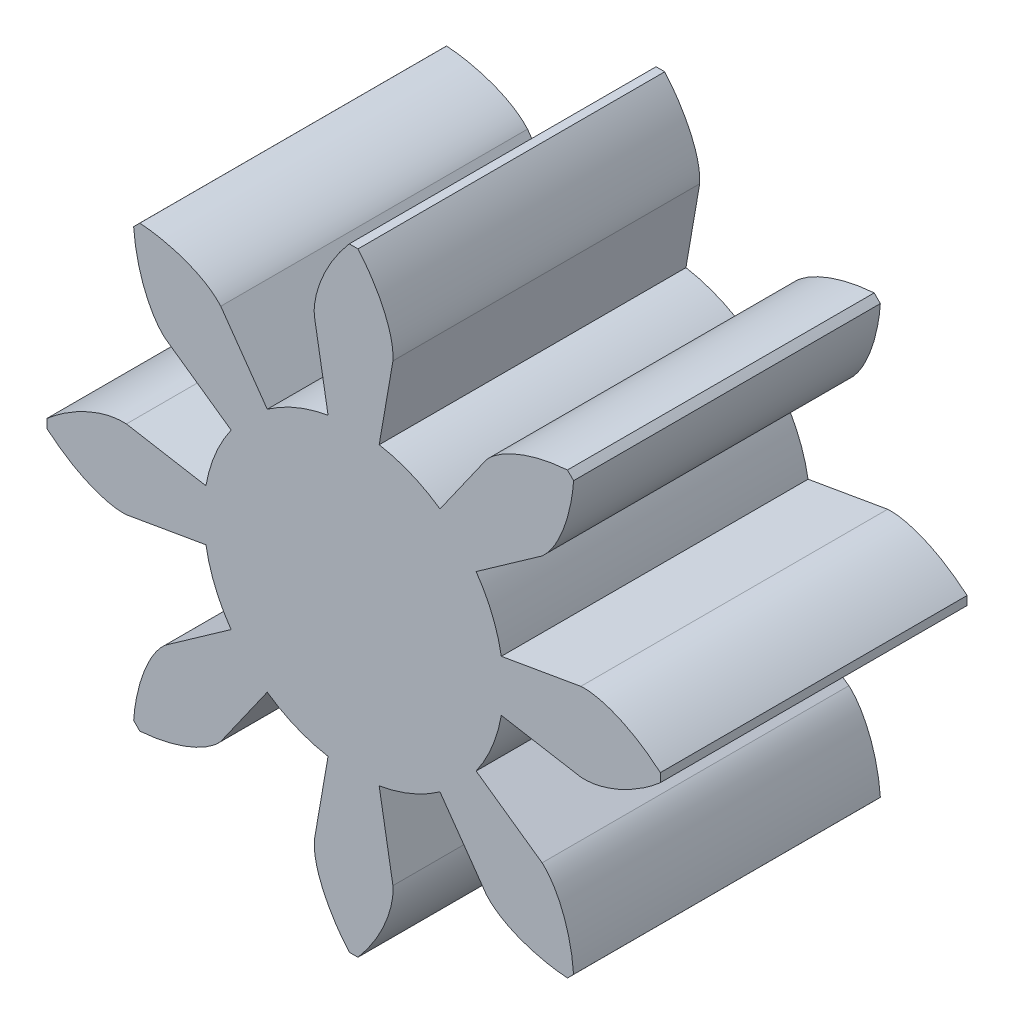
from build123d import *

# Parameters (mm, degrees)
BOSS_EXTRUDE1_DEPTH = 5
CIRPATTERN1_COUNT   = 8
SKETCH2_R           = 2.443200814
BOSS_EXTRUDE2_DEPTH = 5


with BuildPart() as part:
    # Sketch1 → Boss-Extrude1 (new body)
    with BuildSketch(Plane.XY.offset(5)):
        with BuildLine():
            Line((0.41659025, 2.407422435), (0.640908077, 3.703726823))
            add(Edge.make_bspline(
                [(0.640908077, 3.703726823), (0.680350197, 4.297153912), (0.071093186, 4.99949455)],
                knots=[0.50407462, 0.50407462, 0.50407462, 1.738238777, 1.738238777, 1.738238777], degree=2, weights=[1, 0.815570405, 1]))
            ThreePointArc((0.071093186, 4.99949455), (0, 5), (-0.071093186, 4.99949455))
            add(Edge.make_bspline(
                [(-0.071093186, 4.99949455), (-0.684119659, 4.29533983), (-0.640908077, 3.703726823)],
                knots=[4.493136736, 4.493136736, 4.493136736, 5.781201385, 5.781201385, 5.781201385], degree=2, weights=[1, 0.799681158, 1]))
            Line((-0.640908077, 3.703726823), (-0.41659025, 2.407422435))
            Line((-0.41659025, 2.407422435), (0.41659025, 2.407422435))
        make_face()
    extrude(amount=-BOSS_EXTRUDE1_DEPTH)


with BuildPart() as cirpattern1_1:
    # CirPattern1: pattern copy
    add(part.part.rotate(Axis((0, 0, 0), (0, 0, 1)), 1 * 360 / CIRPATTERN1_COUNT))


with BuildPart() as cirpattern1_2:
    # CirPattern1: pattern copy
    add(part.part.rotate(Axis((0, 0, 0), (0, 0, 1)), 2 * 360 / CIRPATTERN1_COUNT))


with BuildPart() as cirpattern1_3:
    # CirPattern1: pattern copy
    add(part.part.rotate(Axis((0, 0, 0), (0, 0, 1)), 3 * 360 / CIRPATTERN1_COUNT))


with BuildPart() as cirpattern1_4:
    # CirPattern1: pattern copy
    add(part.part.rotate(Axis((0, 0, 0), (0, 0, 1)), 4 * 360 / CIRPATTERN1_COUNT))


with BuildPart() as cirpattern1_5:
    # CirPattern1: pattern copy
    add(part.part.rotate(Axis((0, 0, 0), (0, 0, 1)), 5 * 360 / CIRPATTERN1_COUNT))


with BuildPart() as cirpattern1_6:
    # CirPattern1: pattern copy
    add(part.part.rotate(Axis((0, 0, 0), (0, 0, 1)), 6 * 360 / CIRPATTERN1_COUNT))


with BuildPart() as cirpattern1_7:
    # CirPattern1: pattern copy
    add(part.part.rotate(Axis((0, 0, 0), (0, 0, 1)), 7 * 360 / CIRPATTERN1_COUNT))


with BuildPart() as part_1:
    add(part.part)

    add(cirpattern1_1.part)  # Boss-Extrude2 merges CirPattern1_1

    add(cirpattern1_2.part)  # Boss-Extrude2 merges CirPattern1_2

    add(cirpattern1_3.part)  # Boss-Extrude2 merges CirPattern1_3

    add(cirpattern1_4.part)  # Boss-Extrude2 merges CirPattern1_4

    add(cirpattern1_5.part)  # Boss-Extrude2 merges CirPattern1_5

    add(cirpattern1_6.part)  # Boss-Extrude2 merges CirPattern1_6

    add(cirpattern1_7.part)  # Boss-Extrude2 merges CirPattern1_7
    # Sketch2 → Boss-Extrude2 (add)
    with BuildSketch(Plane.XY.offset(5)):
        Circle(SKETCH2_R)
    extrude(amount=-BOSS_EXTRUDE2_DEPTH)


solid = part_1.part
